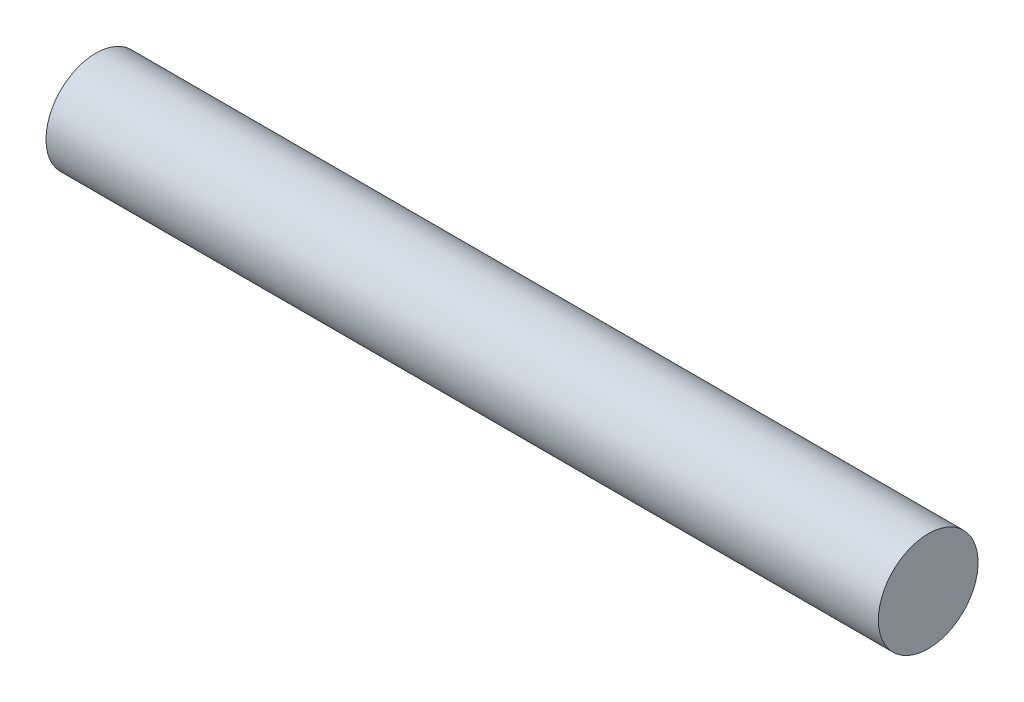
from build123d import *

# Parameters (mm, degrees)
SKETCH1_R           = 4
BOSS_EXTRUDE1_DEPTH = 45.2
BOSS_EXTRUDE2_START = 21.59
SKETCH2_R           = 4
BOSS_EXTRUDE2_DEPTH = 21.59


with BuildPart() as part:
    # Sketch1 → Boss-Extrude1 (new body)
    with BuildSketch(Plane(origin=(0, 0, 0), x_dir=(0, 0, -1), z_dir=(1, 0, 0))):
        with Locations(Location((0, 0, 0), (0, 0, 180))):
            Circle(SKETCH1_R)
    extrude(amount=BOSS_EXTRUDE1_DEPTH)

    # Sketch2 → Boss-Extrude2 (add)
    with BuildSketch(Plane.ZY.offset(BOSS_EXTRUDE2_START)):
        Circle(SKETCH2_R)
    extrude(amount=-BOSS_EXTRUDE2_DEPTH)


solid = part.part
